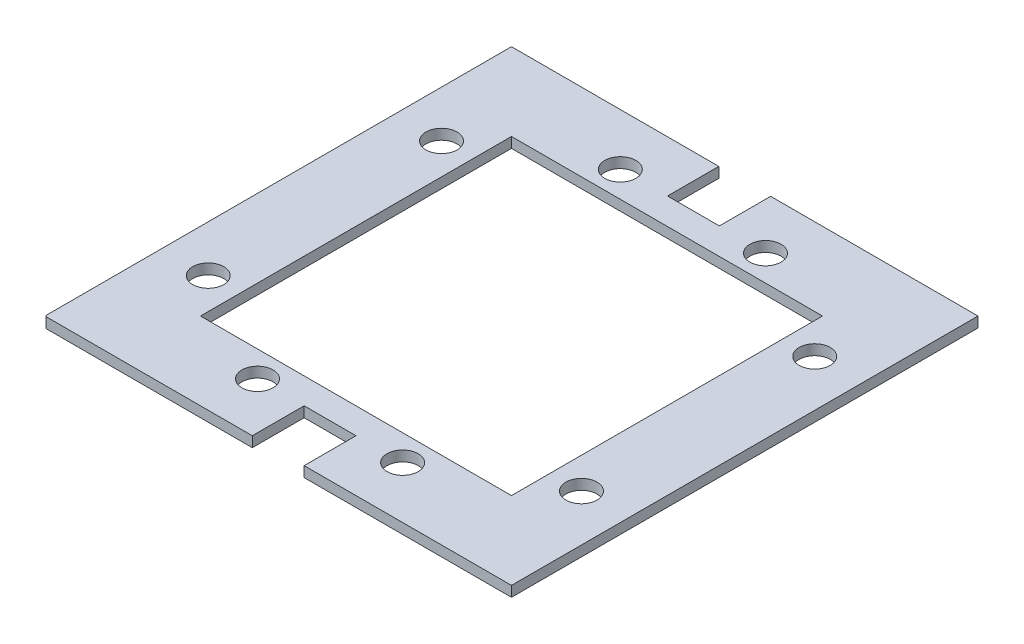
from build123d import *

# Parameters (mm, degrees)
CROQUIS1_R              = 1.5
CROQUIS1_W              = 30
CROQUIS1_H              = 30
SALIENTE_EXTRUIR1_DEPTH = 1
CROQUIS3_W              = 5
CROQUIS3_H              = 4.949226591
CROQUIS3_H_2            = 5
CORTAR_EXTRUIR2_DEPTH   = 10


with BuildPart() as part:
    # Croquis1 → Saliente-Extruir1 (new body)
    with BuildSketch(Plane(origin=(0, 0, 0), x_dir=(1, 0, 0), z_dir=(0, 1, 0))):
        with BuildLine():
            ThreePointArc((-7.5, -7.398453182), (-7.449747468, -7.449747468), (-7.398453182, -7.5))
            Line((-7.398453182, -7.5), (37.5, -7.5))
            Line((37.5, -7.5), (37.5, 37.5))
            Line((37.5, 37.5), (-7.5, 37.5))
            Line((-7.5, 37.5), (-7.5, -7.398453182))
        make_face()
        with Locations(Location((8, -2.5, 0), (0, 0, 270))):
            Circle(CROQUIS1_R, mode=Mode.SUBTRACT)
        with Locations(Location((-3, 3.75, 0), (0, 0, 270))):
            Circle(CROQUIS1_R, mode=Mode.SUBTRACT)
        with Locations(Location((22, -2.5, 0), (0, 0, 270))):
            Circle(CROQUIS1_R, mode=Mode.SUBTRACT)
        with Locations(Location((33, 3.75, 0), (0, 0, 270))):
            Circle(CROQUIS1_R, mode=Mode.SUBTRACT)
        with Locations(Location((-3, 26.25, 0), (0, 0, 270))):
            Circle(CROQUIS1_R, mode=Mode.SUBTRACT)
        with Locations(Location((8, 32.5, 0), (0, 0, 270))):
            Circle(CROQUIS1_R, mode=Mode.SUBTRACT)
        with Locations((15, 15)):
            Rectangle(CROQUIS1_W, CROQUIS1_H, mode=Mode.SUBTRACT)
        with Locations(Location((22, 32.5, 0), (0, 0, 270))):
            Circle(CROQUIS1_R, mode=Mode.SUBTRACT)
        with Locations(Location((33, 26.25, 0), (0, 0, 270))):
            Circle(CROQUIS1_R, mode=Mode.SUBTRACT)
    extrude(amount=SALIENTE_EXTRUIR1_DEPTH)

    # Croquis3 → Cortar-Extruir2 (cut)
    with BuildSketch(Plane(origin=(0, 1, 0), x_dir=(1, 0, 0), z_dir=(0, 1, 0))):
        with Locations((15, 35.025386705)):
            Rectangle(CROQUIS3_W, CROQUIS3_H)
        with Locations((15, -5)):
            Rectangle(CROQUIS3_W, CROQUIS3_H_2)
    extrude(amount=-CORTAR_EXTRUIR2_DEPTH, mode=Mode.SUBTRACT)


solid = part.part
